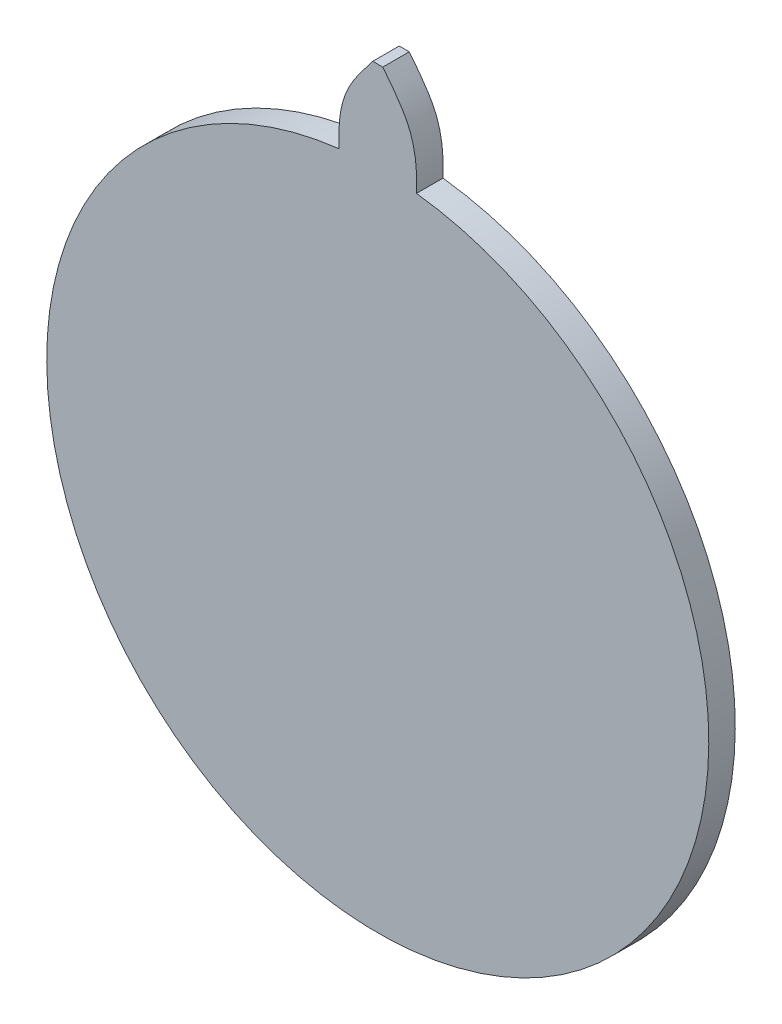
from build123d import *

# Parameters (mm, degrees)
SKETCH1_R           = 34.933496267
BOSS_EXTRUDE1_DEPTH = 2.793999854
BOSS_EXTRUDE2_DEPTH = 2.793999854


with BuildPart() as part:
    # Sketch1 → Boss-Extrude1 (new body)
    with BuildSketch(Plane.XY):
        Circle(SKETCH1_R)
    extrude(amount=BOSS_EXTRUDE1_DEPTH)

    # Sketch2 → Boss-Extrude2 (add)
    with BuildSketch(Plane.XY):
        with BuildLine():
            Line((-0.529295357, 44.460813049), (0.529295357, 44.460813049))
            add(Edge.make_bspline(
                [(0.529295357, 44.460813049), (1.611499664, 43.097136359), (4.77306458, 39.113274573), (4.095608896, 33.906117048), (3.650046429, 30.48137059)],
                knots=[0, 0, 0, 0, 0.342300201, 1, 1, 1, 1], degree=3))
            ThreePointArc((3.650046429, 30.48137059), (0, 30.699133407), (-3.650046429, 30.48137059))
            add(Edge.make_bspline(
                [(-0.529295357, 44.460813049), (-1.611499664, 43.097136359), (-4.77306458, 39.113274573), (-4.095608896, 33.906117048), (-3.650046429, 30.48137059)],
                knots=[0, 0, 0, 0, 0.342300201, 1, 1, 1, 1], degree=3))
        make_face()
    extrude(amount=BOSS_EXTRUDE2_DEPTH)


solid = part.part
